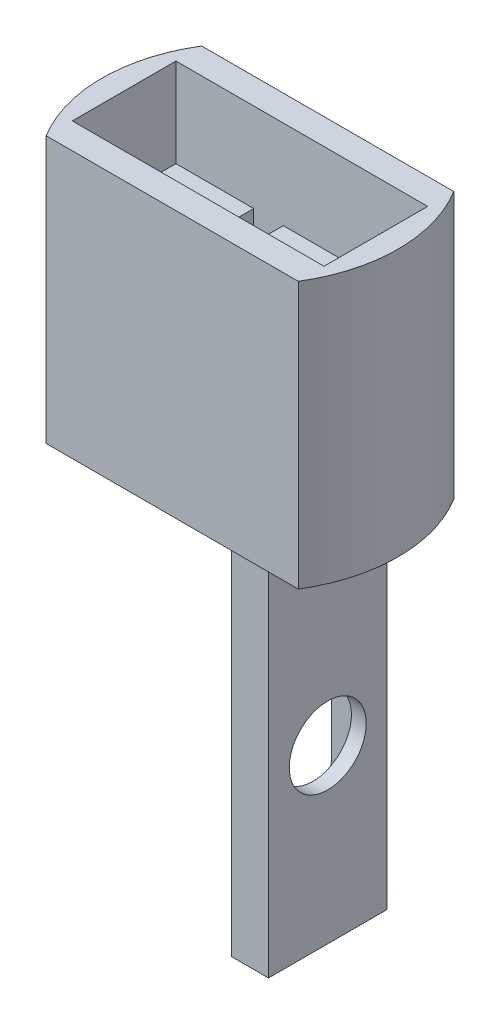
from build123d import *

# Parameters (mm, degrees)
SKETCH3_R           = 10
BOSS_EXTRUDE1_DEPTH = 18
SKETCH4_W           = 2.5
SKETCH4_H           = 8
BOSS_EXTRUDE2_DEPTH = 25
CUT_EXTRUDE1_REACH  = 32.945
SKETCH5_R           = 2.6
SKETCH6_W           = 5.5
SKETCH6_H           = 21
CUT_EXTRUDE2_DEPTH  = 1.5
SKETCH7_W           = 17
SKETCH7_H           = 7
CUT_EXTRUDE3_DEPTH  = 6
SKETCH8_W           = 2
SKETCH8_H           = 7
CUT_EXTRUDE4_DEPTH  = 4
BOSS_EXTRUDE3_DEPTH = 1.5
CUT_EXTRUDE5_REACH  = 30.723


with BuildPart() as part:
    # Sketch3 → Boss-Extrude1 (new body)
    with BuildSketch(Plane(origin=(0, 0, 0), x_dir=(1, 0, 0), z_dir=(0, 1, 0))):
        with Locations(Location((0, 0, 0), (0, 0, 270))):
            Circle(SKETCH3_R)
    extrude(amount=BOSS_EXTRUDE1_DEPTH)

    # Sketch4 → Boss-Extrude2 (add)
    with BuildSketch(Plane(origin=(0, 0, 0), x_dir=(-1, 0, 0), z_dir=(0, -1, 0))):
        with Locations((-4, 0)):
            Rectangle(SKETCH4_W, SKETCH4_H)
    extrude(amount=BOSS_EXTRUDE2_DEPTH)

    # Sketch5 → Cut-Extrude1 (cut, up to next)
    with BuildSketch(Plane(origin=(5.25, 0, 0), x_dir=(0, 0, -1), z_dir=(1, 0, 0)), mode=Mode.PRIVATE) as cut_extrude1_sk1:
        with Locations((0, -13.4)):
            Circle(SKETCH5_R)
    cut_extrude1_tool1 = extrude(cut_extrude1_sk1.sketch, amount=-CUT_EXTRUDE1_REACH, mode=Mode.PRIVATE) & part.part
    add(cut_extrude1_tool1.solids().sort_by_distance((5.25, -13.4, 0))[0], mode=Mode.SUBTRACT)

    # Sketch6 → Cut-Extrude2 (cut)
    with BuildSketch(Plane.ZY.offset(-2.75)):
        with Locations((0, -13.4)):
            Rectangle(SKETCH6_W, SKETCH6_H)
    extrude(amount=-CUT_EXTRUDE2_DEPTH, mode=Mode.SUBTRACT)

    # Sketch7 → Cut-Extrude3 (cut)
    with BuildSketch(Plane(origin=(0, 18, 0), x_dir=(1, 0, 0), z_dir=(0, 1, 0))):
        Rectangle(SKETCH7_W, SKETCH7_H)
    extrude(amount=-CUT_EXTRUDE3_DEPTH, mode=Mode.SUBTRACT)

    # Sketch8 → Cut-Extrude4 (cut)
    with BuildSketch(Plane(origin=(0, 12, 0), x_dir=(1, 0, 0), z_dir=(0, 1, 0))):
        with Locations((-2.25, 0)):
            Rectangle(SKETCH8_W, SKETCH8_H)
    extrude(amount=-CUT_EXTRUDE4_DEPTH, mode=Mode.SUBTRACT)

    # Sketch9 → Boss-Extrude3 (add)
    with BuildSketch(Plane.ZY.offset(-4.25)):
        Polygon((-2.75, -23.9), (-2.75, -16.9), (-1.5, -23.9), align=None)
        Polygon((1.5, -23.9), (2.75, -23.9), (2.75, -16.9), align=None)
        Polygon((2.75, -2.9), (2.75, -9.9), (1.5, -2.9), align=None)
        Polygon((-1.5, -2.9), (-2.75, -2.9), (-2.75, -9.9), align=None)
    extrude(amount=BOSS_EXTRUDE3_DEPTH)

    # Sketch11 → Cut-Extrude5 (cut, up to next)
    with BuildSketch(Plane(origin=(0, 0, 0), x_dir=(-1, 0, 0), z_dir=(0, -1, 0)), mode=Mode.PRIVATE) as cut_extrude5_sk1:
        with BuildLine():
            Line((8.511022265, 5.25), (-8.511022265, 5.25))
            ThreePointArc((-8.511022265, 5.25), (0, 10), (8.511022265, 5.25))
        make_face()
    cut_extrude5_tool1 = extrude(cut_extrude5_sk1.sketch, amount=-CUT_EXTRUDE5_REACH, mode=Mode.PRIVATE) & part.part
    # Sketch11 → Cut-Extrude5 (cut, up to next)
    with BuildSketch(Plane(origin=(0, 0, 0), x_dir=(-1, 0, 0), z_dir=(0, -1, 0)), mode=Mode.PRIVATE) as cut_extrude5_sk2:
        with BuildLine():
            Line((8.511022265, -5.25), (-8.511022265, -5.25))
            ThreePointArc((-8.511022265, -5.25), (0, -10), (8.511022265, -5.25))
        make_face()
    cut_extrude5_tool2 = extrude(cut_extrude5_sk2.sketch, amount=-CUT_EXTRUDE5_REACH, mode=Mode.PRIVATE) & part.part
    add(cut_extrude5_tool1.solids().sort_by_distance((0, 0, -7.194917))[0], mode=Mode.SUBTRACT)
    add(cut_extrude5_tool2.solids().sort_by_distance((0, 0, 7.194917))[0], mode=Mode.SUBTRACT)


solid = part.part
